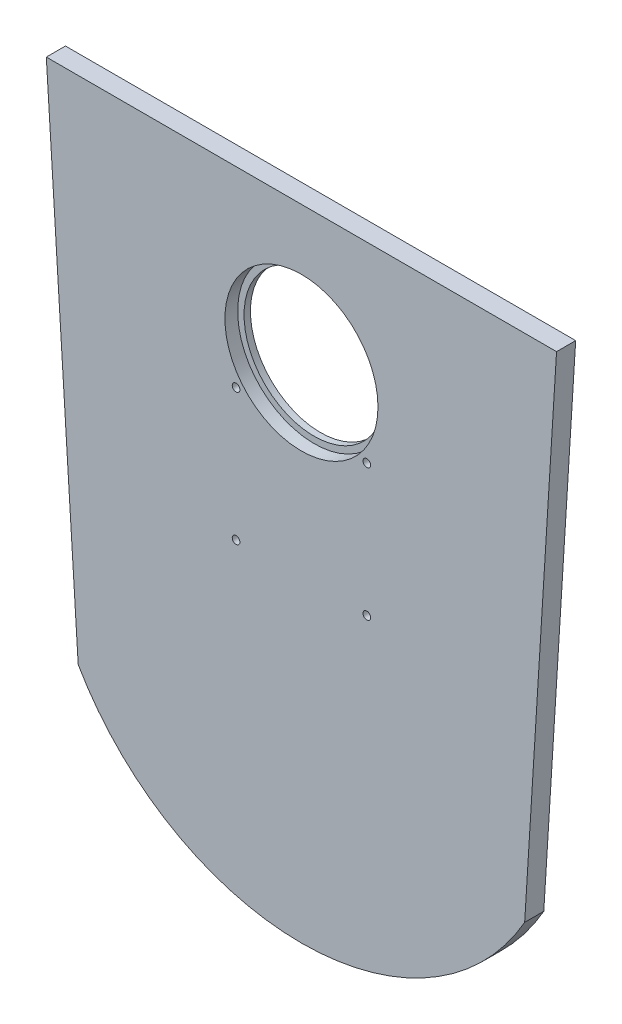
from build123d import *

# Parameters (mm, degrees)
SKETCH_1_W          = 70
SKETCH_1_H          = 80
EXTRUDE_1_DEPTH     = 3
CUT_EXTRUDE_1_REACH = 108.344
SKETCH_2_R          = 0.6
SKETCH_2_R_2        = 11
SKETCH_3_R          = 12
CUT_EXTRUDE_2_DEPTH = 2
EXTRUDE_2_DEPTH     = 3


with BuildPart() as part:
    # 草图1 → 凸台-拉伸1 (new body)
    with BuildSketch(Plane.XY):
        with Locations((35, 40)):
            Rectangle(SKETCH_1_W, SKETCH_1_H)
    extrude(amount=EXTRUDE_1_DEPTH)

    # 草图2 → 切除-拉伸1 (cut, up to next)
    with BuildSketch(Plane.XY.offset(3), mode=Mode.PRIVATE) as cut_extrude_1_sk1:
        with Locations((24.75, 50)):
            Circle(SKETCH_2_R)
    cut_extrude_1_tool1 = extrude(cut_extrude_1_sk1.sketch, amount=-CUT_EXTRUDE_1_REACH, mode=Mode.PRIVATE) & part.part
    # 草图2 → 切除-拉伸1 (cut, up to next)
    with BuildSketch(Plane.XY.offset(3), mode=Mode.PRIVATE) as cut_extrude_1_sk2:
        with Locations((45.25, 50)):
            Circle(SKETCH_2_R)
    cut_extrude_1_tool2 = extrude(cut_extrude_1_sk2.sketch, amount=-CUT_EXTRUDE_1_REACH, mode=Mode.PRIVATE) & part.part
    # 草图2 → 切除-拉伸1 (cut, up to next)
    with BuildSketch(Plane.XY.offset(3), mode=Mode.PRIVATE) as cut_extrude_1_sk3:
        with Locations((45.25, 29.3)):
            Circle(SKETCH_2_R)
    cut_extrude_1_tool3 = extrude(cut_extrude_1_sk3.sketch, amount=-CUT_EXTRUDE_1_REACH, mode=Mode.PRIVATE) & part.part
    # 草图2 → 切除-拉伸1 (cut, up to next)
    with BuildSketch(Plane.XY.offset(3), mode=Mode.PRIVATE) as cut_extrude_1_sk4:
        with Locations((24.75, 29.3)):
            Circle(SKETCH_2_R)
    cut_extrude_1_tool4 = extrude(cut_extrude_1_sk4.sketch, amount=-CUT_EXTRUDE_1_REACH, mode=Mode.PRIVATE) & part.part
    # 草图2 → 切除-拉伸1 (cut, up to next)
    with BuildSketch(Plane.XY.offset(3), mode=Mode.PRIVATE) as cut_extrude_1_sk5:
        with Locations((35, 58.5)):
            Circle(SKETCH_2_R_2)
    cut_extrude_1_tool5 = extrude(cut_extrude_1_sk5.sketch, amount=-CUT_EXTRUDE_1_REACH, mode=Mode.PRIVATE) & part.part
    add(cut_extrude_1_tool1.solids().sort_by_distance((24.75, 50, 3))[0], mode=Mode.SUBTRACT)
    add(cut_extrude_1_tool2.solids().sort_by_distance((45.25, 50, 3))[0], mode=Mode.SUBTRACT)
    add(cut_extrude_1_tool3.solids().sort_by_distance((45.25, 29.3, 3))[0], mode=Mode.SUBTRACT)
    add(cut_extrude_1_tool4.solids().sort_by_distance((24.75, 29.3, 3))[0], mode=Mode.SUBTRACT)
    add(cut_extrude_1_tool5.solids().sort_by_distance((35, 58.5, 3))[0], mode=Mode.SUBTRACT)

    # 草图3 → 切除-拉伸2 (cut)
    with BuildSketch(Plane.XY.offset(3)):
        with Locations((35, 58.5)):
            Circle(SKETCH_3_R)
    extrude(amount=-CUT_EXTRUDE_2_DEPTH, mode=Mode.SUBTRACT)

    # 草图5 → 凸台-拉伸2 (add)
    with BuildSketch(Plane(origin=(0, 0, 0), x_dir=(-1, 0, 0), z_dir=(0, 0, -1))):
        Polygon((-75, 80), (-70, 80), (-70, 0), align=None)
        Polygon((0, 0), (5, 80), (0, 80), align=None)
        with BuildLine():
            Line((0, 0), (-35, 0))
            Line((-35, 0), (-35, -20.311288741))
            ThreePointArc((-35, -20.311288741), (-14.766683105, -14.865640499), (0, 0))
        make_face()
        with BuildLine():
            Line((-35, -20.311288741), (-35, 0))
            Line((-35, 0), (-70, 0))
            ThreePointArc((-70, 0), (-55.233316895, -14.865640499), (-35, -20.311288741))
        make_face()
        with BuildLine():
            Line((0, 0), (-35, 0))
            Line((-35, 0), (-35, -20.311288741))
            ThreePointArc((-35, -20.311288741), (-14.766683105, -14.865640499), (0, 0))
        make_face()
        with BuildLine():
            Line((-35, -20.311288741), (-35, 0))
            Line((-35, 0), (-70, 0))
            ThreePointArc((-70, 0), (-55.233316895, -14.865640499), (-35, -20.311288741))
        make_face()
    extrude(amount=-EXTRUDE_2_DEPTH)


solid = part.part
